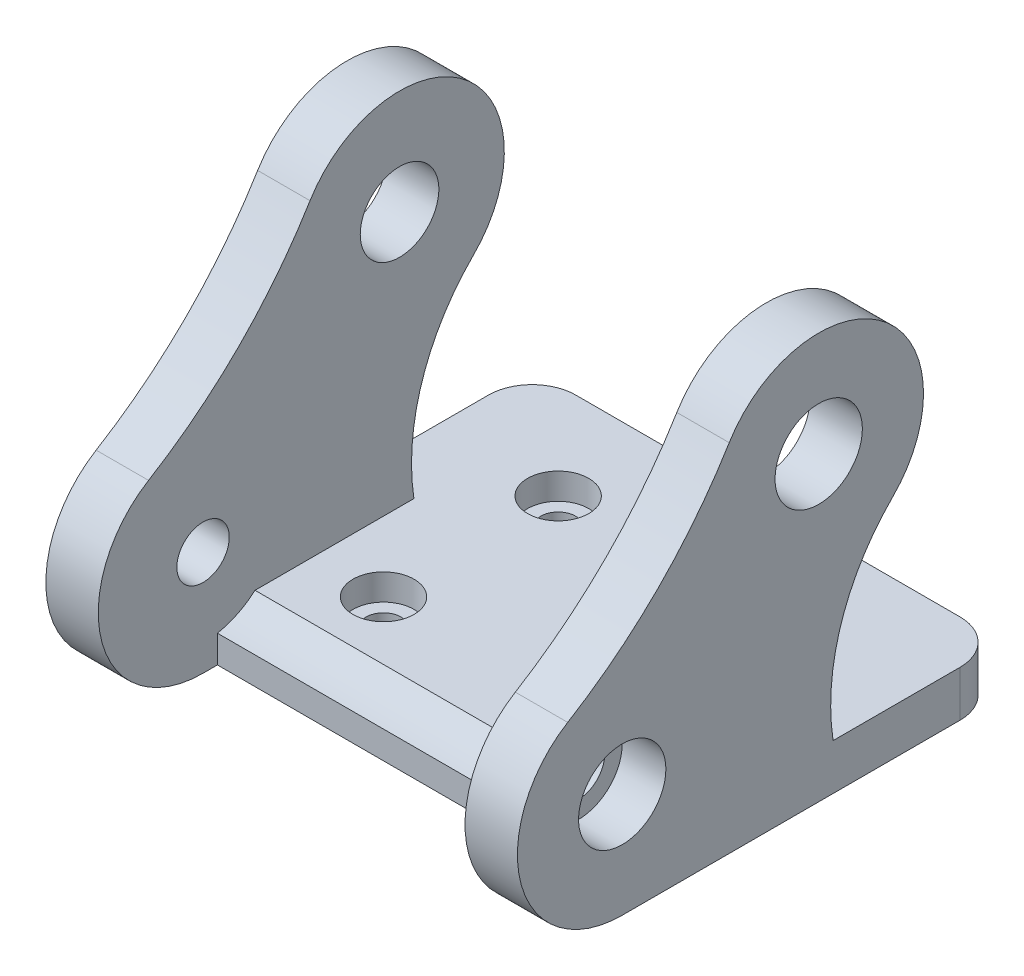
from build123d import *

# Parameters (mm, degrees)
SKETCH_1_R                      = 8
EXTRUDE_1_DEPTH                 = 4
SKETCH_7_R                      = 3.333333333
CUT_EXTRUDE_3_DEPTH             = 33.771939216
SKETCH_8_R                      = 2
CUT_EXTRUDE_4_DEPTH             = 33.771939216
EXTRUDE_START                   = 28
SKETCH_9_R                      = 3
SKETCH_9_R_2                    = 2
EXTRUDE_2_DEPTH                 = 4
EXTRUDE_3_REACH                 = 47.629
SKETCH_10_W                     = 13.024468831
SKETCH_10_H                     = 3.5
SKETCH_11_W                     = 28
SKETCH_11_H                     = 3.5
EXTRUDE_4_DEPTH                 = 15
SCALE_1_SCALE                   = 1.5
CUT_EXTRUDE_5_DEPTH             = 42
SKETCH_17_R                     = 6
CUT_EXTRUDE_6_DEPTH             = 1.4
SKETCH_18_R                     = 5
CUT_EXTRUDE_7_DEPTH             = 5
CUT_EXTRUDE_8_REACH             = 72.05
SKETCH_19_R                     = 2
CUT_EXTRUDE_8_DIRECTION_2_DEPTH = 71.050046232
FILLET_1_R                      = 5
SKETCH_21_R                     = 3.5
CUT_EXTRUDE_9_DEPTH             = 3


with BuildPart() as part:
    # 草图1 → 凸台-拉伸1 (new body)
    with BuildSketch(Plane(origin=(0, 0, 0), x_dir=(0, 0, -1), z_dir=(1, 0, 0))):
        with BuildLine():
            ThreePointArc((-7, -15), (-9.343145751, -20.656854249), (-15, -23))
            Line((-15, -23), (14.121578143, -23))
            Line((14.121578143, -23), (14.121578143, -19.5))
            Line((14.121578143, -19.5), (1.097109312, -19.5))
            ThreePointArc((1.097109312, -19.5), (1.721982831, -12.038332525), (5.650082252, -5.66361815))
            ThreePointArc((5.650082252, -5.66361815), (-4.947792662, -6.286441583), (-6.832692698, 4.161046803))
            ThreePointArc((-6.832692698, 4.161046803), (-12.258618637, -2.741381363), (-19.161046803, -8.167307302))
            ThreePointArc((-19.161046803, -8.167307302), (-11.081350642, -8.025461506), (-7, -15))
        make_face()
        with Locations((-15, -15)):
            Circle(SKETCH_1_R)
        Circle(SKETCH_1_R)
    extrude(amount=EXTRUDE_1_DEPTH)

    # 草图7 → 切除-拉伸3 (cut, through all)
    with BuildSketch(Plane(origin=(4, 0, 0), x_dir=(0, 0, -1), z_dir=(1, 0, 0))):
        Circle(SKETCH_7_R)
    extrude(amount=-CUT_EXTRUDE_3_DEPTH, mode=Mode.SUBTRACT)

    # 草图8 → 切除-拉伸4 (cut, through all)
    with BuildSketch(Plane(origin=(4, 0, 0), x_dir=(0, 0, -1), z_dir=(1, 0, 0))):
        with Locations((-15, -15)):
            Circle(SKETCH_8_R)
    extrude(amount=-CUT_EXTRUDE_4_DEPTH, mode=Mode.SUBTRACT)


with BuildPart() as body_2:
    # 草图9 → 凸台-拉伸2 (new body)
    with BuildSketch(Plane.ZY.offset(EXTRUDE_START)):
        with BuildLine():
            Line((-1.097109312, -19.5), (-14.121578143, -19.5))
            Line((-14.121578143, -19.5), (-14.121578143, -23))
            Line((-14.121578143, -23), (15, -23))
            ThreePointArc((15, -23), (22.702646999, -17.160839931), (19.161046803, -8.167307302))
            ThreePointArc((19.161046803, -8.167307302), (12.258618637, -2.741381363), (6.832692698, 4.161046803))
            ThreePointArc((6.832692698, 4.161046803), (-4.947792662, 6.286441583), (-5.650082252, -5.66361815))
            ThreePointArc((-5.650082252, -5.66361815), (-1.721982831, -12.038332525), (-1.097109312, -19.5))
        make_face()
        Circle(SKETCH_9_R, mode=Mode.SUBTRACT)
        with Locations(Location((15, -15, 0), (0, 0, 180))):
            Circle(SKETCH_9_R_2, mode=Mode.SUBTRACT)
    extrude(amount=EXTRUDE_2_DEPTH)

    # 草图10 → 凸台-拉伸3 (add, up to next)
    with BuildSketch(Plane.ZY, mode=Mode.PRIVATE) as extrude_3_sk1:
        with Locations((-7.609343728, -21.25)):
            Rectangle(SKETCH_10_W, SKETCH_10_H)
    extrude_3_tool1 = extrude(extrude_3_sk1.sketch, amount=EXTRUDE_3_REACH, mode=Mode.PRIVATE) - body_2.part

    add(part.part)  # 凸台-拉伸3 merges part
    add(extrude_3_tool1.solids().sort_by_distance((0, -21.25, -7.609344))[0])

    # 草图11 → 凸台-拉伸4 (add)
    with BuildSketch(Plane.XY.offset(-1.097109312)):
        with Locations((-14, -21.25)):
            Rectangle(SKETCH_11_W, SKETCH_11_H)
    extrude(amount=EXTRUDE_4_DEPTH)


with BuildPart() as body_2_1:
    # 缩放比例1: scaled about (-14.05550312, -14.324036163, 3.699652839)
    add(body_2.part.scale(SCALE_1_SCALE).moved(Location((7.02775156, 7.162018082, -1.84982642))))

    # 草图13 → 切除-拉伸5 (cut)
    with BuildSketch(Plane(origin=(-34.97224844, 0, 0), x_dir=(0, 0, -1), z_dir=(1, 0, 0))):
        with BuildLine():
            Line((-14.697233131, -22.087981919), (-19.004509613, -22.087981919))
            Line((-19.004509613, -22.087981919), (-19.004509613, -24.186246726))
            ThreePointArc((-19.004509613, -24.186246726), (-16.708679438, -23.42900311), (-14.697233131, -22.087981919))
        make_face()
    extrude(amount=CUT_EXTRUDE_5_DEPTH, mode=Mode.SUBTRACT)

    # 草图17 → 切除-拉伸6 (cut)
    with BuildSketch(Plane.ZY.offset(40.97224844)):
        with Locations((20.650173581, -15.337981919)):
            Circle(SKETCH_17_R)
    extrude(amount=-CUT_EXTRUDE_6_DEPTH, mode=Mode.SUBTRACT)

    # 草图18 → 切除-拉伸7 (cut)
    with BuildSketch(Plane(origin=(13.02775156, 0, 0), x_dir=(0, 0, -1), z_dir=(1, 0, 0))):
        with Locations((-20.650173581, -15.337981919)):
            Circle(SKETCH_18_R)
    extrude(amount=-CUT_EXTRUDE_7_DEPTH, mode=Mode.SUBTRACT)

    # 草图19 → 切除-拉伸8 (cut, up to next)
    with BuildSketch(Plane.XZ.offset(27.337981919), mode=Mode.PRIVATE) as cut_extrude_8_sk1:
        with Locations(Location((-0.97224844, -12.01384201, 0), (0, 0, 90))):
            Circle(SKETCH_19_R)
    cut_extrude_8_tool1 = extrude(cut_extrude_8_sk1.sketch, amount=-CUT_EXTRUDE_8_REACH, mode=Mode.PRIVATE) & body_2_1.part
    # 草图19 → 切除-拉伸8 (cut, up to next)
    with BuildSketch(Plane.XZ.offset(27.337981919), mode=Mode.PRIVATE) as cut_extrude_8_sk2:
        with Locations(Location((-26.97224844, -12.01384201, 0), (0, 0, 90))):
            Circle(SKETCH_19_R)
    cut_extrude_8_tool2 = extrude(cut_extrude_8_sk2.sketch, amount=-CUT_EXTRUDE_8_REACH, mode=Mode.PRIVATE) & body_2_1.part
    # 草图19 → 切除-拉伸8 (cut, up to next)
    with BuildSketch(Plane.XZ.offset(27.337981919), mode=Mode.PRIVATE) as cut_extrude_8_sk3:
        with Locations(Location((-26.97224844, 7.98615799, 0), (0, 0, 90))):
            Circle(SKETCH_19_R)
    cut_extrude_8_tool3 = extrude(cut_extrude_8_sk3.sketch, amount=-CUT_EXTRUDE_8_REACH, mode=Mode.PRIVATE) & body_2_1.part
    # 草图19 → 切除-拉伸8 (cut, up to next)
    with BuildSketch(Plane.XZ.offset(27.337981919), mode=Mode.PRIVATE) as cut_extrude_8_sk4:
        with Locations(Location((-0.97224844, 7.98615799, 0), (0, 0, 90))):
            Circle(SKETCH_19_R)
    cut_extrude_8_tool4 = extrude(cut_extrude_8_sk4.sketch, amount=-CUT_EXTRUDE_8_REACH, mode=Mode.PRIVATE) & body_2_1.part
    add(cut_extrude_8_tool1.solids().sort_by_distance((-0.972248, -27.337982, -12.013842))[0], mode=Mode.SUBTRACT)
    add(cut_extrude_8_tool2.solids().sort_by_distance((-26.972248, -27.337982, -12.013842))[0], mode=Mode.SUBTRACT)
    add(cut_extrude_8_tool3.solids().sort_by_distance((-26.972248, -27.337982, 7.986158))[0], mode=Mode.SUBTRACT)
    add(cut_extrude_8_tool4.solids().sort_by_distance((-0.972248, -27.337982, 7.986158))[0], mode=Mode.SUBTRACT)

    # 草图19 → 切除-拉伸8 direction 2 (cut)
    with BuildSketch(Plane.XZ.offset(27.337981919)):
        with Locations(Location((-0.97224844, -12.01384201, 0), (0, 0, 90))):
            Circle(SKETCH_19_R)
        with Locations(Location((-26.97224844, -12.01384201, 0), (0, 0, 90))):
            Circle(SKETCH_19_R)
        with Locations(Location((-26.97224844, 7.98615799, 0), (0, 0, 90))):
            Circle(SKETCH_19_R)
        with Locations(Location((-0.97224844, 7.98615799, 0), (0, 0, 90))):
            Circle(SKETCH_19_R)
    extrude(amount=CUT_EXTRUDE_8_DIRECTION_2_DEPTH, mode=Mode.SUBTRACT)

    # 圆角1
    fillet_1_edges = [body_2_1.edges().sort_by_distance(p)[0] for p in [
        (13.02775156, -24.712981919, -23.032193634),
        (-40.97224844, -24.712981919, -23.032193634),
    ]]
    fillet(fillet_1_edges, radius=FILLET_1_R)

    # 草图21 → 切除-拉伸9 (cut)
    with BuildSketch(Plane(origin=(0, -22.087981919, 0), x_dir=(1, 0, 0), z_dir=(0, 1, 0))):
        with Locations(Location((-26.97224844, 12.01384201, 0), (0, 0, 270))):
            Circle(SKETCH_21_R)
        with Locations(Location((-0.97224844, 12.01384201, 0), (0, 0, 270))):
            Circle(SKETCH_21_R)
        with Locations(Location((-0.97224844, -7.98615799, 0), (0, 0, 270))):
            Circle(SKETCH_21_R)
        with Locations(Location((-26.97224844, -7.98615799, 0), (0, 0, 270))):
            Circle(SKETCH_21_R)
    extrude(amount=-CUT_EXTRUDE_9_DEPTH, mode=Mode.SUBTRACT)


solid = body_2_1.part
